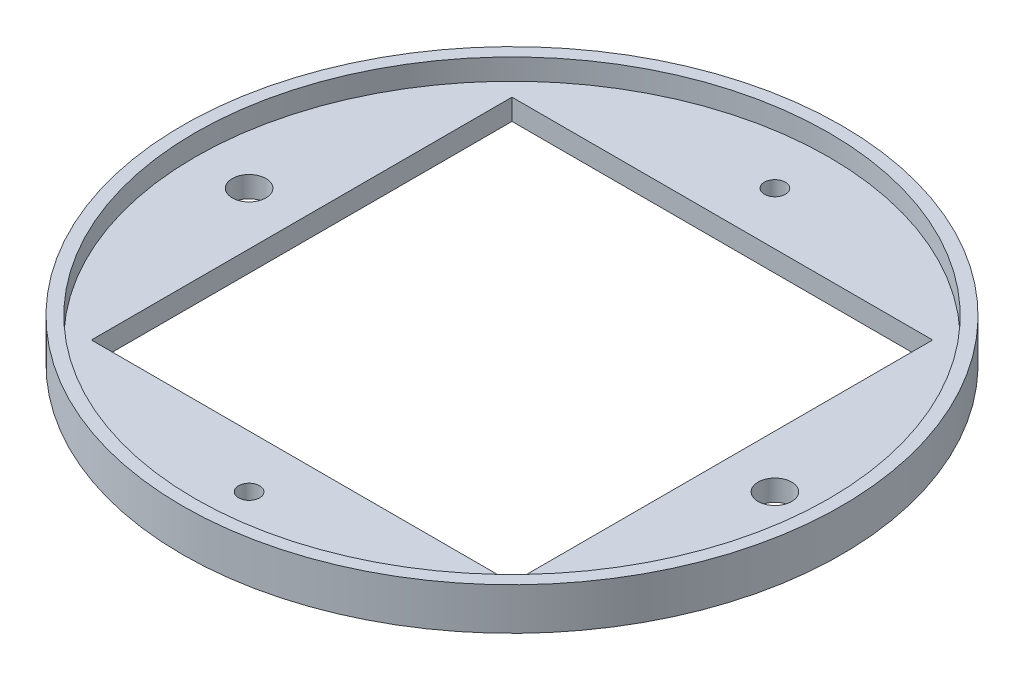
from build123d import *

# Parameters (mm, degrees)
SKETCH1_R           = 78.35
SKETCH1_R_2         = 4
SKETCH1_R_3         = 2.5
SKETCH1_W           = 100
SKETCH1_H           = 100
BOSS_EXTRUDE1_DEPTH = 5
SKETCH2_R           = 78.35
SKETCH2_R_2         = 75.35
BOSS_EXTRUDE2_DEPTH = 5


with BuildPart() as part:
    # Sketch1 → Boss-Extrude1 (new body)
    with BuildSketch(Plane(origin=(0, 0, 0), x_dir=(1, 0, 0), z_dir=(0, 1, 0))):
        with Locations(Location((0, 0, 0), (0, 0, 270))):
            Circle(SKETCH1_R)
        with Locations(Location((-62.5, 0, 0), (0, 0, 270))):
            Circle(SKETCH1_R_2, mode=Mode.SUBTRACT)
        with Locations(Location((62.5, 0, 0), (0, 0, 270))):
            Circle(SKETCH1_R_2, mode=Mode.SUBTRACT)
        with Locations(Location((0, 62.5, 0), (0, 0, 270))):
            Circle(SKETCH1_R_3, mode=Mode.SUBTRACT)
        with Locations(Location((0, -62.5, 0), (0, 0, 270))):
            Circle(SKETCH1_R_3, mode=Mode.SUBTRACT)
        Rectangle(SKETCH1_W, SKETCH1_H, mode=Mode.SUBTRACT)
    extrude(amount=BOSS_EXTRUDE1_DEPTH)

    # Sketch2 → Boss-Extrude2 (add)
    with BuildSketch(Plane(origin=(0, 5, 0), x_dir=(1, 0, 0), z_dir=(0, 1, 0))):
        with Locations(Location((0, 0, 0), (0, 0, 270))):
            Circle(SKETCH2_R)
        with Locations(Location((0, 0, 0), (0, 0, 270))):
            Circle(SKETCH2_R_2, mode=Mode.SUBTRACT)
    extrude(amount=BOSS_EXTRUDE2_DEPTH)


solid = part.part
